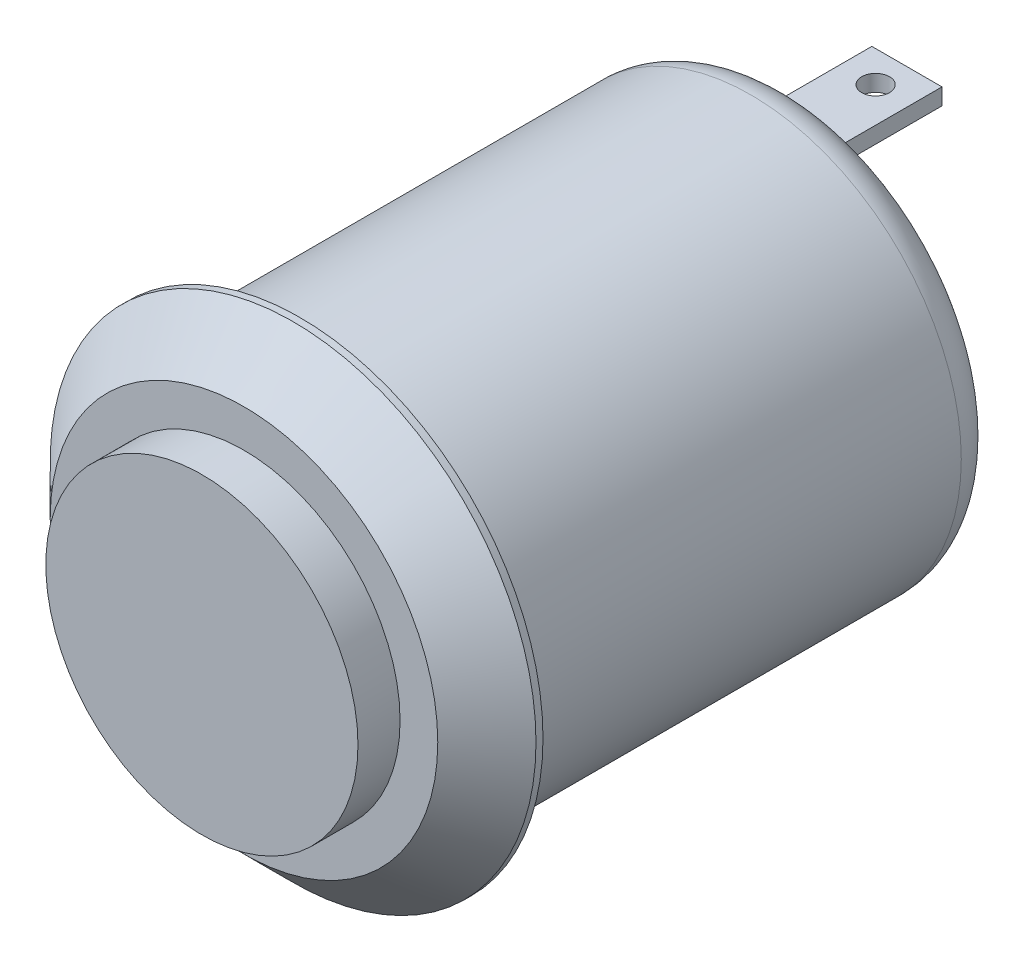
from build123d import *

# Parameters (mm, degrees)
SKETCH1_R           = 6
BOSS_EXTRUDE1_DEPTH = 14
SKETCH2_R           = 6.925
BOSS_EXTRUDE2_DEPTH = 1.6
CHAMFER1_SIZE       = 1.4
SKETCH3_R           = 4.45
BOSS_EXTRUDE3_DEPTH = 1.2
FILLET1_R           = 1.15
SKETCH5_W           = 2
SKETCH5_H           = 0.47
BOSS_EXTRUDE4_DEPTH = 3.3
SKETCH6_R           = 0.395429062
CUT_EXTRUDE1_DEPTH  = 22.84242775


with BuildPart() as part:
    # Sketch1 → Boss-Extrude1 (new body)
    with BuildSketch(Plane.XY):
        Circle(SKETCH1_R)
    extrude(amount=-BOSS_EXTRUDE1_DEPTH)

    # Sketch2 → Boss-Extrude2 (add)
    with BuildSketch(Plane.XY):
        Circle(SKETCH2_R)
    extrude(amount=BOSS_EXTRUDE2_DEPTH)

    # Chamfer1
    chamfer1_edges = [part.edges().sort_by_distance(p)[0] for p in [
        (-6.925, 0, 1.6),
    ]]
    chamfer(chamfer1_edges, length=CHAMFER1_SIZE)

    # Sketch3 → Boss-Extrude3 (add)
    with BuildSketch(Plane.XY.offset(1.6)):
        Circle(SKETCH3_R)
    extrude(amount=BOSS_EXTRUDE3_DEPTH)

    # Fillet1
    fillet1_edges = [part.edges().sort_by_distance(p)[0] for p in [
        (-6, 0, -14),
    ]]
    fillet(fillet1_edges, radius=FILLET1_R)

    # Sketch5 → Boss-Extrude4 (add)
    with BuildSketch(Plane(origin=(0, 0, -14), x_dir=(-1, 0, 0), z_dir=(0, 0, -1))):
        with Locations((0, -4.235)):
            Rectangle(SKETCH5_W, SKETCH5_H)
        with Locations((0, 4.235)):
            Rectangle(SKETCH5_W, SKETCH5_H)
    extrude(amount=BOSS_EXTRUDE4_DEPTH)

    # Sketch6 → Cut-Extrude1 (cut, through all)
    with BuildSketch(Plane(origin=(0, 4.47, 0), x_dir=(1, 0, 0), z_dir=(0, 1, 0))):
        with Locations(Location((0, 16.408005075, 0), (0, 0, 270))):
            Circle(SKETCH6_R)
    extrude(amount=-CUT_EXTRUDE1_DEPTH, mode=Mode.SUBTRACT)


solid = part.part
